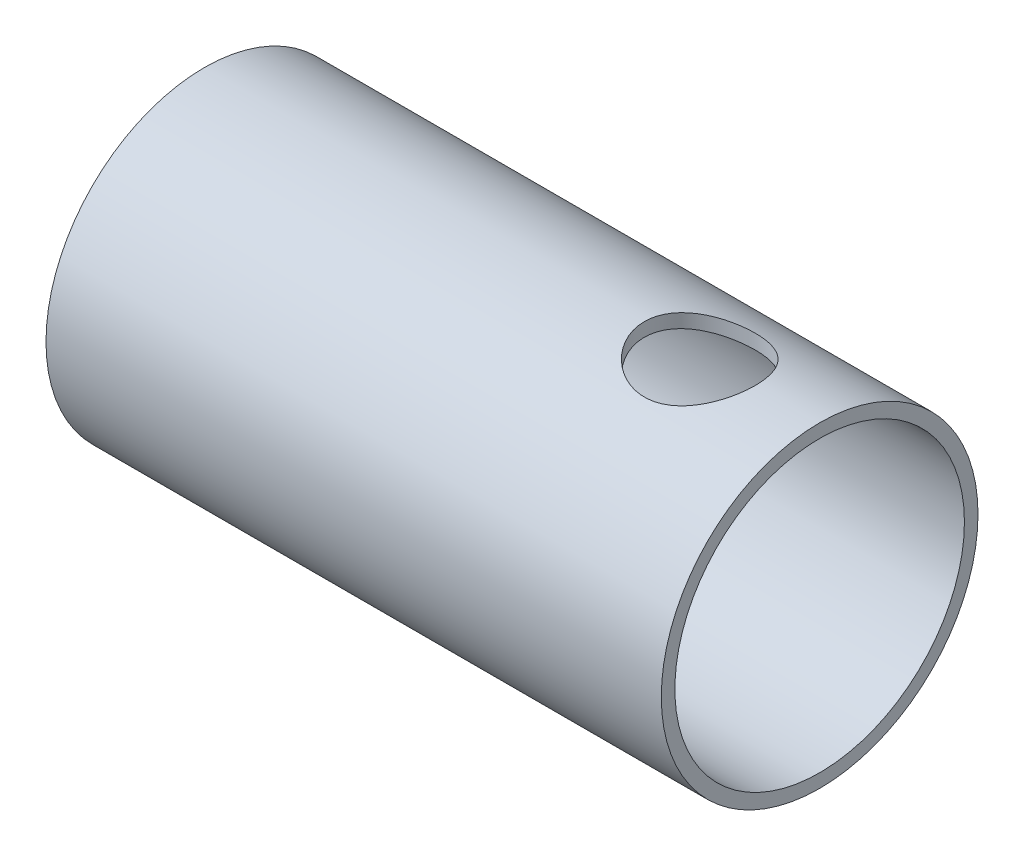
from build123d import *

# Parameters (mm, degrees)
SKETCH3_R           = 35
SKETCH3_R_2         = 32
BOSS_EXTRUDE1_DEPTH = 68
SKETCH4_R           = 12.25
CUT_EXTRUDE1_DEPTH  = 85.107074613
SKETCH5_R           = 12.25
CUT_EXTRUDE2_DEPTH  = 85.107074777


with BuildPart() as part:
    # Sketch3 → Boss-Extrude1 (new, symmetric)
    with BuildSketch(Plane(origin=(0, 0, 0), x_dir=(0, 0, -1), z_dir=(1, 0, 0))):
        Circle(SKETCH3_R)
        Circle(SKETCH3_R_2, mode=Mode.SUBTRACT)
    extrude(amount=BOSS_EXTRUDE1_DEPTH, both=True)

    # Sketch4 → Cut-Extrude1 (cut, through all)
    with BuildSketch(Plane(origin=(0, 0, 0), x_dir=(1, 0, 0), z_dir=(0, 1, 0))):
        with Locations(Location((-41.5, 0, 0), (0, 0, 270))):
            Circle(SKETCH4_R)
    extrude(amount=-CUT_EXTRUDE1_DEPTH, mode=Mode.SUBTRACT)

    # Sketch5 → Cut-Extrude2 (cut, through all)
    with BuildSketch(Plane(origin=(0, 0, 0), x_dir=(1, 0, 0), z_dir=(0, 1, 0))):
        with Locations(Location((41.5, 0, 0), (0, 0, 90))):
            Circle(SKETCH5_R)
    extrude(amount=CUT_EXTRUDE2_DEPTH, mode=Mode.SUBTRACT)


solid = part.part
